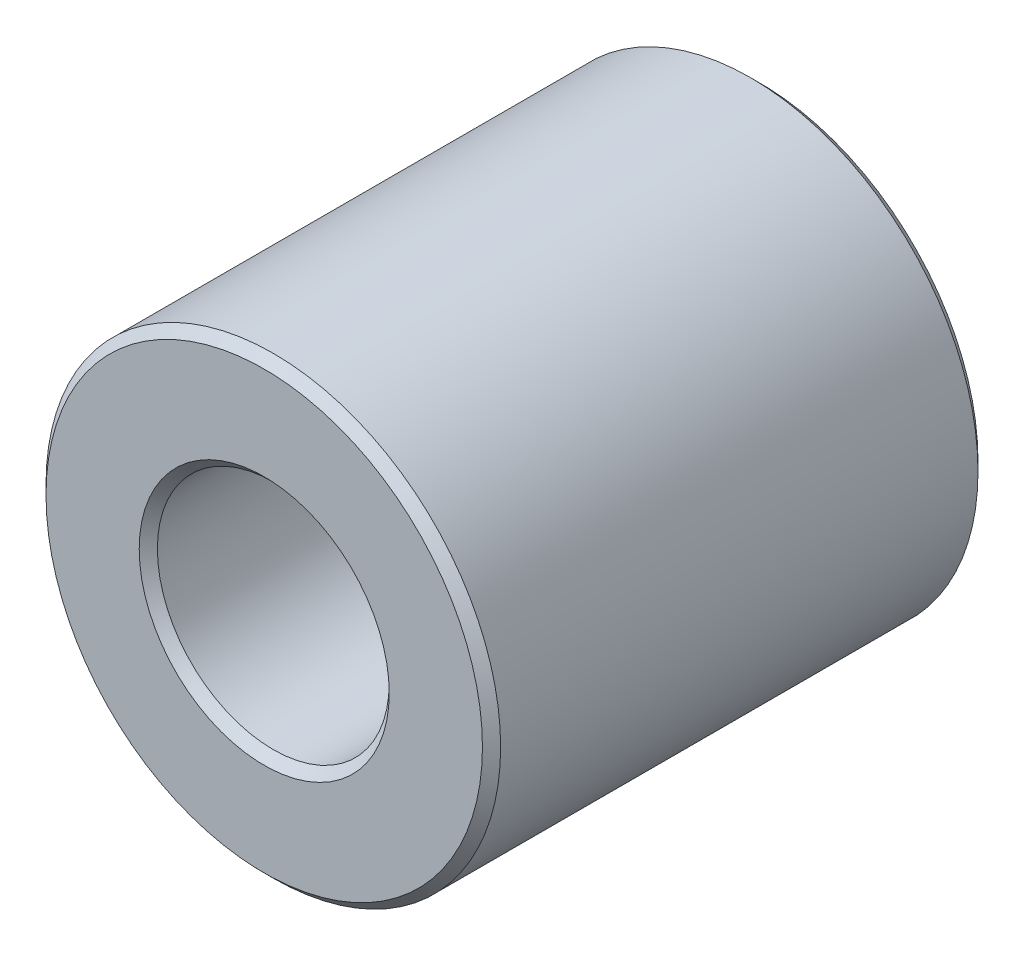
from build123d import *

# Parameters (mm, degrees)
SKETCH1_R           = 5
SKETCH1_R_2         = 2.55
BOSS_EXTRUDE1_DEPTH = 10.9
CHAMFER1_SIZE       = 0.2


with BuildPart() as part:
    # Sketch1 → Boss-Extrude1 (new body)
    with BuildSketch(Plane.XY):
        Circle(SKETCH1_R)
        Circle(SKETCH1_R_2, mode=Mode.SUBTRACT)
    extrude(amount=BOSS_EXTRUDE1_DEPTH)

    # Chamfer1
    chamfer1_edges = [part.edges().sort_by_distance(p)[0] for p in [
        (-5, 0, 0),
        (-5, 0, 10.9),
        (-2.55, 0, 0),
        (-2.55, 0, 10.9),
    ]]
    chamfer(chamfer1_edges, length=CHAMFER1_SIZE)


solid = part.part
